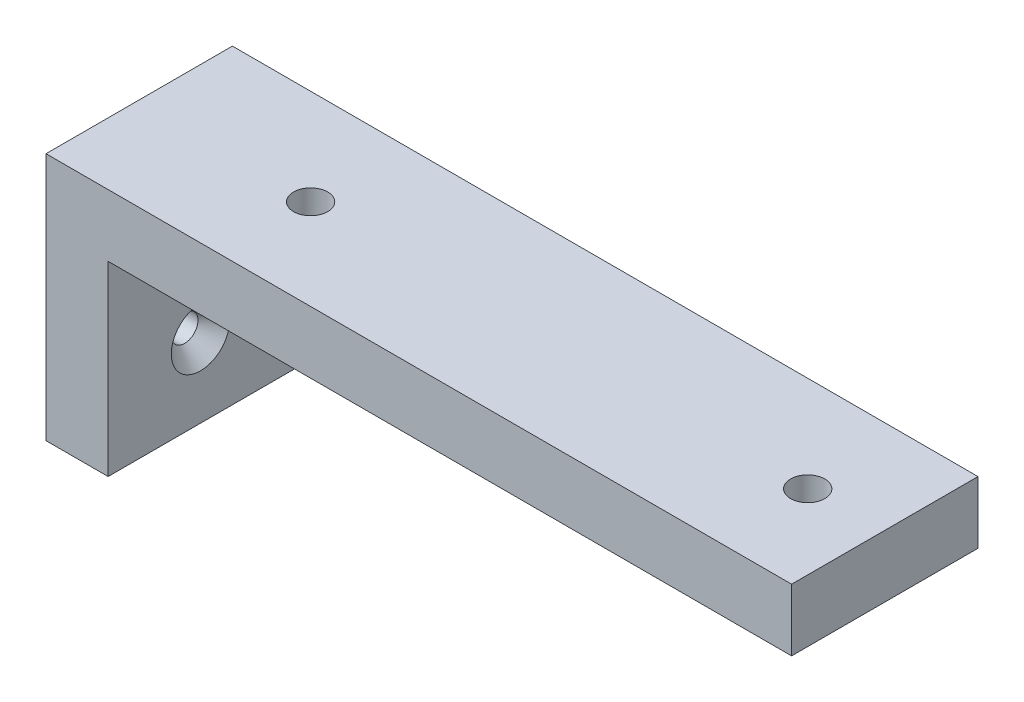
from build123d import *

# Parameters (mm, degrees)
BOSS_EXTRUDE1_DEPTH                                  = 30
CBORE_FOR_M5_HEX_HEAD_BOLT1_D                        = 5.5
CBORE_FOR_M5_HEX_HEAD_BOLT1_CBORE_D                  = 12.238
CBORE_FOR_M5_HEX_HEAD_BOLT1_CBORE_DEPTH              = 3.5
CSK_FOR_M4_COUNTERSUNK_RAISED_HEAD_SCREW_D           = 4.3
CSK_FOR_M4_COUNTERSUNK_RAISED_HEAD_SCREW_CSINK_D     = 9.4
CSK_FOR_M4_COUNTERSUNK_RAISED_HEAD_SCREW_CSINK_ANGLE = 90


with BuildPart() as part:
    # Sketch1 → Boss-Extrude1 (new body)
    with BuildSketch(Plane.XY):
        Polygon((0, 0), (0, 40), (120, 40), (120, 30), (10, 30), (10, 0), align=None)
    extrude(amount=BOSS_EXTRUDE1_DEPTH)

    # CBORE for M5 Hex Head Bolt1 (through all)
    with Locations(Plane(origin=(0, 30, 0), x_dir=(-1, 0, 0), z_dir=(0, -1, 0))):
        with Locations((-108, -15.41009868), (-28, -15.41009868)):
            CounterBoreHole(CBORE_FOR_M5_HEX_HEAD_BOLT1_D / 2, CBORE_FOR_M5_HEX_HEAD_BOLT1_CBORE_D / 2, CBORE_FOR_M5_HEX_HEAD_BOLT1_CBORE_DEPTH)

    # CSK for M4 Countersunk Raised Head Screw1 (through all)
    with Locations(Plane(origin=(10, 0, 0), x_dir=(0, 0, -1), z_dir=(1, 0, 0))):
        with Locations((-15.137848296, 12)):
            CounterSinkHole(CSK_FOR_M4_COUNTERSUNK_RAISED_HEAD_SCREW_D / 2, CSK_FOR_M4_COUNTERSUNK_RAISED_HEAD_SCREW_CSINK_D / 2, counter_sink_angle=CSK_FOR_M4_COUNTERSUNK_RAISED_HEAD_SCREW_CSINK_ANGLE)


solid = part.part
